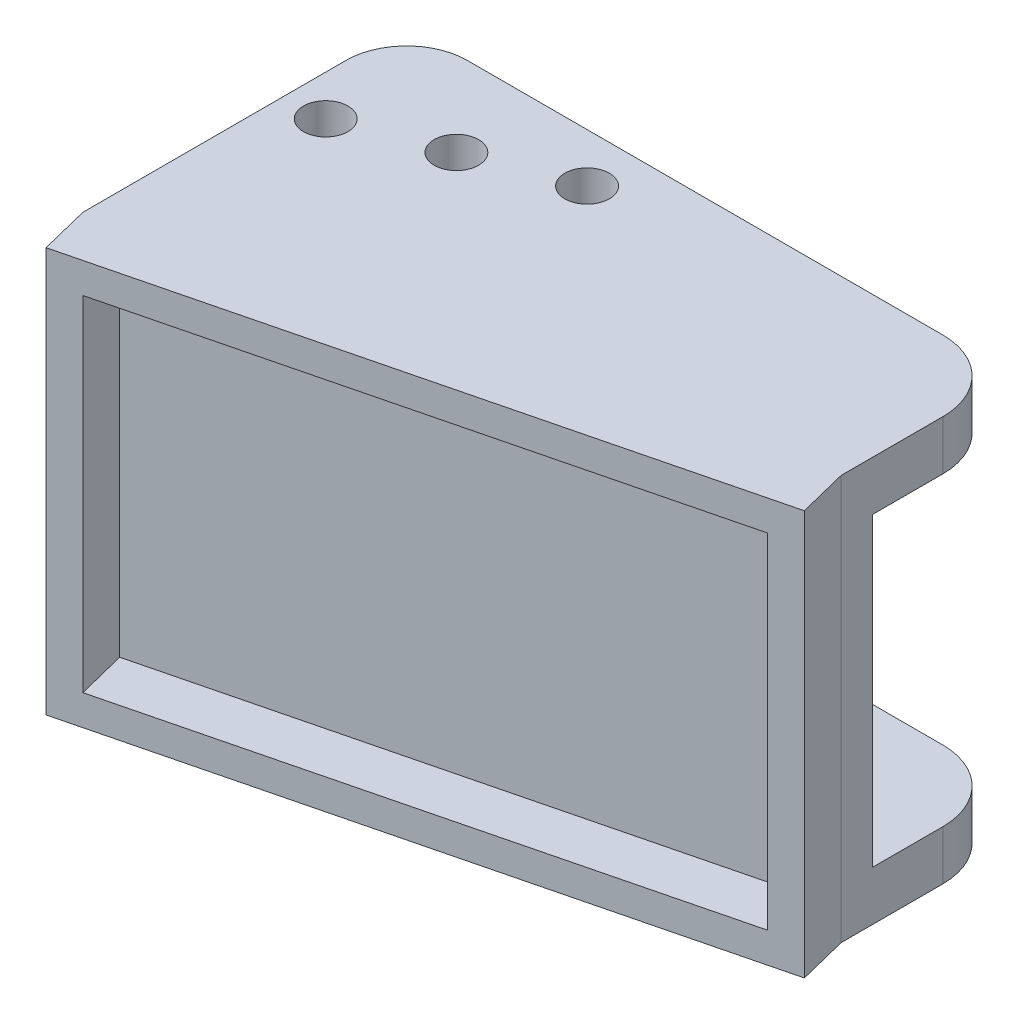
from build123d import *

# Parameters (mm, degrees)
EXTRUDE_1_DEPTH     = 20
SKETCH_2_R          = 1.1
CUT_EXTRUDE_2_DEPTH = 27.248809497
CUT_EXTRUDE_3_REACH = 31.682
SKETCH_3_W          = 30
SKETCH_3_H          = 15.1
FILLET_1_R          = 3
SKETCH_6_W          = 30.918408881
SKETCH_6_H          = 20
SKETCH_6_W_2        = 27.918408881
SKETCH_6_H_2        = 17
EXTRUDE_2_DEPTH     = 2.5
FILLET_2_R          = 3.5


with BuildPart() as part:
    # 草图1 → 凸台-拉伸1 (new body)
    with BuildSketch(Plane(origin=(0, 0, 0), x_dir=(1, 0, 0), z_dir=(0, 1, 0))):
        Polygon((-15, -8), (15, -0.520159915), (15, 8), (-15, 8), align=None)
    extrude(amount=EXTRUDE_1_DEPTH)

    # 草图2 → 切除-拉伸2 (cut, through all)
    with BuildSketch(Plane(origin=(0, 20, 0), x_dir=(1, 0, 0), z_dir=(0, 1, 0))):
        with Locations(Location((-13, 2, 0), (0, 0, 270))):
            Circle(SKETCH_2_R)
        with Locations(Location((-8.332097868, 3.791839748, 0), (0, 0, 270))):
            Circle(SKETCH_2_R)
        with Locations(Location((-3.664195735, 5.583679495, 0), (0, 0, 270))):
            Circle(SKETCH_2_R)
    extrude(amount=-CUT_EXTRUDE_2_DEPTH, mode=Mode.SUBTRACT)

    # 切除-拉伸3: up to this plane
    cut_extrude_3_end = Plane(origin=(0.637110354, 0, 2.555310061), z_dir=(0.24192189559966876, 0, 0.9702957262759963))
    # 草图3 → 切除-拉伸3 (cut, up to the surface)
    with BuildSketch(Plane(origin=(0, 0, -8), x_dir=(-1, 0, 0), z_dir=(0, 0, -1)), mode=Mode.PRIVATE) as cut_extrude_3_sk1:
        with Locations((0, 10)):
            Rectangle(SKETCH_3_W, SKETCH_3_H)
    cut_extrude_3_tool1 = split(extrude(cut_extrude_3_sk1.sketch, amount=-CUT_EXTRUDE_3_REACH, mode=Mode.PRIVATE), bisect_by=cut_extrude_3_end, keep=Keep.BOTH, mode=Mode.PRIVATE)
    add(cut_extrude_3_tool1.solids().sort_by_distance((0, 10, -8))[0], mode=Mode.SUBTRACT)

    # 圆角1
    fillet_1_edges = [part.edges().sort_by_distance(p)[0] for p in [
        (-15, 1.225, -8),
        (-15, 18.775, -8),
    ]]
    fillet(fillet_1_edges, radius=FILLET_1_R)

    # 草图6 → 凸台-拉伸2 (add)
    with BuildSketch(Plane(origin=(0.999993198, 0, 4.010753651), x_dir=(0.9702957262759964, 0, -0.2419218955996687), z_dir=(0.2419218955996687, 0, 0.9702957262759964))):
        with Locations((-1.030606619, 10)):
            Rectangle(SKETCH_6_W, SKETCH_6_H)
        with Locations((-1.030606619, 10)):
            Rectangle(SKETCH_6_W_2, SKETCH_6_H_2, mode=Mode.SUBTRACT)
    extrude(amount=EXTRUDE_2_DEPTH)

    # 圆角2
    fillet_2_edges = [part.edges().sort_by_distance(p)[0] for p in [
        (15, 1.225, -8),
        (15, 18.775, -8),
    ]]
    fillet(fillet_2_edges, radius=FILLET_2_R)


solid = part.part
